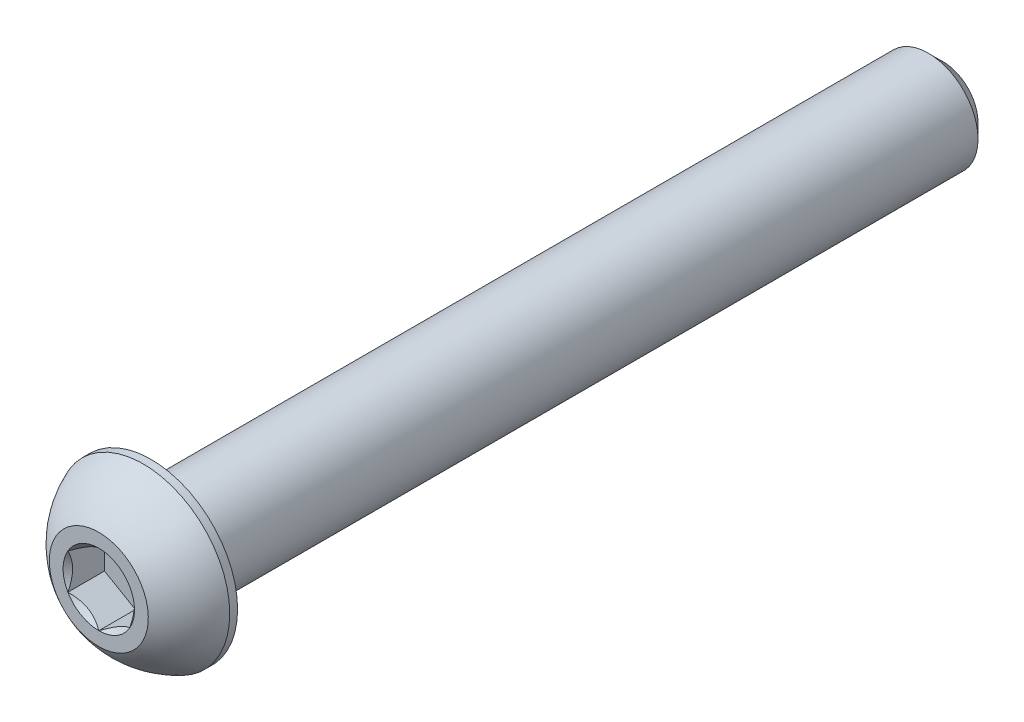
from build123d import *

# Parameters (mm, degrees)
SKETCH1_W          = 50.8
SKETCH1_H          = 3.175
CHAMFER1_SIZE      = 0.929268293
CUT_EXTRUDE2_DEPTH = 2.34696


with BuildPart() as part:
    # Sketch1 → Revolve1 (revolve)
    with BuildSketch(Plane(origin=(0, 0, 0), x_dir=(0, 0, -1), z_dir=(1, 0, 0))):
        with Locations((28.7528, 1.5875)):
            Rectangle(SKETCH1_W, SKETCH1_H)
    revolve(axis=Axis((0, 0, -54.1528), (0, 0, 1)))

    # Chamfer1
    chamfer1_edges = [part.edges().sort_by_distance(p)[0] for p in [
        (0, -3.175, -54.1528),
    ]]
    chamfer(chamfer1_edges, length=CHAMFER1_SIZE)

    # Sketch7 → Revolve2 (revolve)
    with BuildSketch(Plane(origin=(0, 0, 0), x_dir=(0, 0, -1), z_dir=(1, 0, 0))):
        with BuildLine():
            Line((2.84988, 5.5499), (3.3528, 5.5499))
            Line((3.3528, 5.5499), (3.3528, 0))
            Line((3.3528, 0), (0, 0))
            Line((0, 0), (0, 3.175))
            ThreePointArc((0, 3.175), (1.235921075, 4.58927271), (2.84988, 5.5499))
        make_face()
    revolve(axis=Axis((0, 0, 0), (0, 0, -1)))

    # Sketch5 → Cut-Extrude2 (cut)
    with BuildSketch(Plane.XY):
        Polygon((1.984375, -1.14567944), (1.984375, 1.14567944), (0, 2.291358881), (-1.984375, 1.14567944), (-1.984375, -1.14567944), (0, -2.291358881), align=None)
    extrude(amount=-CUT_EXTRUDE2_DEPTH, mode=Mode.SUBTRACT)

    # Cut-Extrude3 cone 1 section (through the dimple's axis) → Cut-Extrude3 (revolve, cut)
    with BuildSketch(Plane(origin=(0, 0, 0), x_dir=(0, -1, 0), z_dir=(1, 0, 0))):
        Polygon((0, 0), (2.291358881, 0), (0, 2.291358881), align=None)
    revolve(axis=Axis((0, 0, 0), (0, 0, -1)), mode=Mode.SUBTRACT)


solid = part.part
